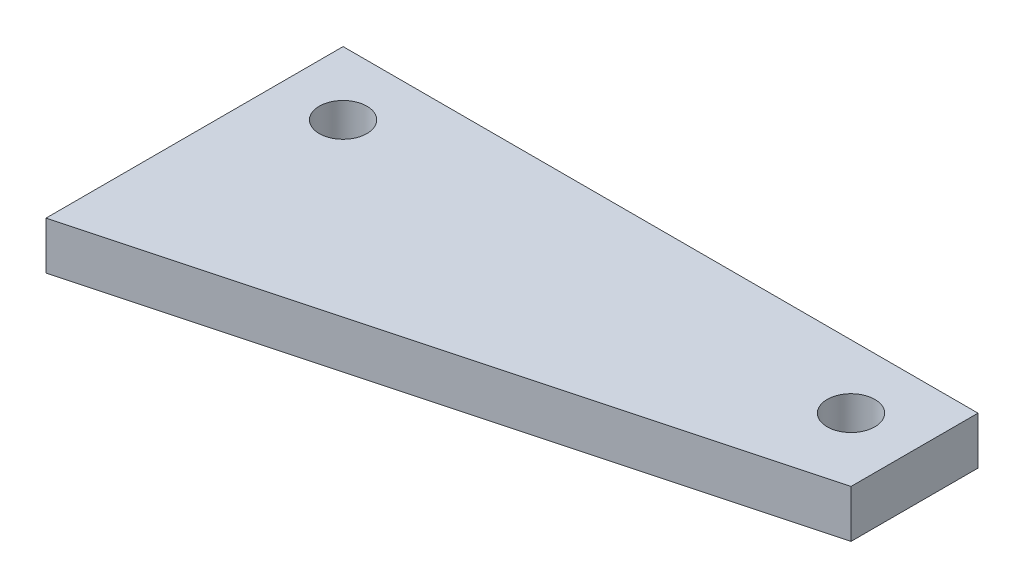
from build123d import *

# Parameters (mm, degrees)
SKETCH1_R           = 2.38125
BOSS_EXTRUDE1_DEPTH = 4.7625


with BuildPart() as part:
    # Sketch1 → Boss-Extrude1 (new body)
    with BuildSketch(Plane(origin=(0, 0, 0), x_dir=(1, 0, 0), z_dir=(0, 1, 0))):
        Polygon((-31.75, -6.35), (-31.75, 6.35), (31.75, 6.35), (31.75, -6.35), (-31.75, -23.364773719), align=None)
        with Locations(Location((-25.4, 0, 0), (0, 0, 90))):
            Circle(SKETCH1_R, mode=Mode.SUBTRACT)
        with Locations(Location((25.4, 0, 0), (0, 0, 90))):
            Circle(SKETCH1_R, mode=Mode.SUBTRACT)
    extrude(amount=BOSS_EXTRUDE1_DEPTH)


solid = part.part
